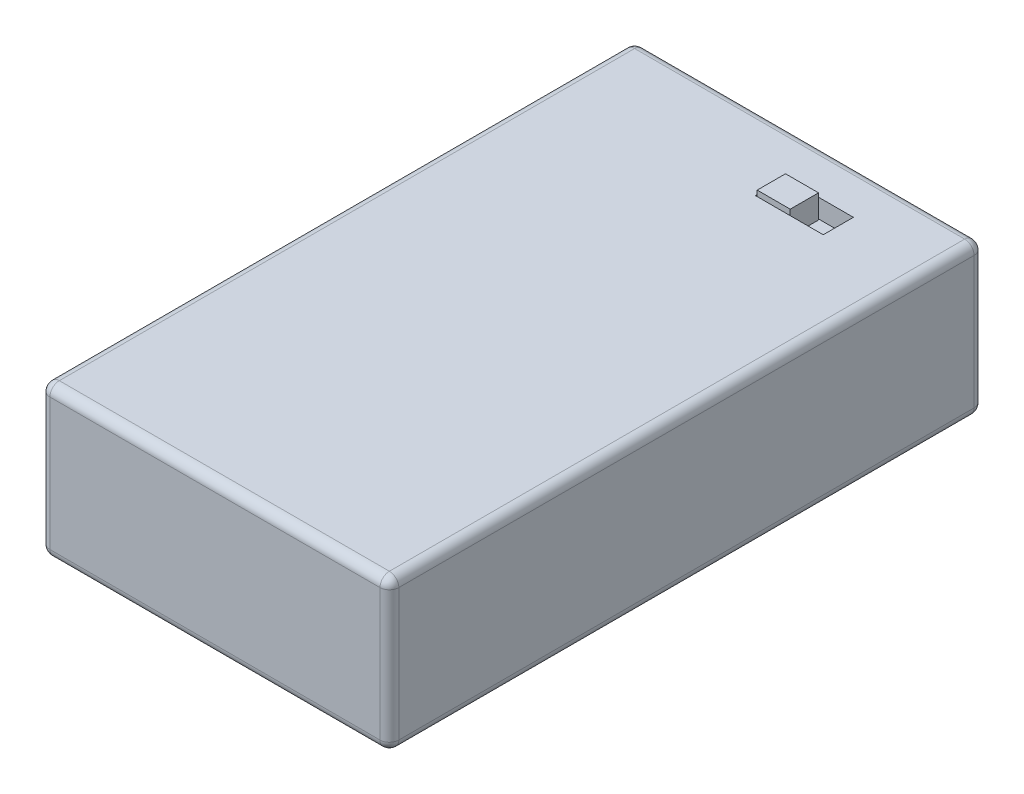
from build123d import *

# Parameters (mm, degrees)
SKETCH_1_W          = 37
SKETCH_1_H          = 63
EXTRUDE_1_DEPTH     = 16
FILLET_1_R          = 1
CUT_EXTRUDE_START   = 16
SKETCH_1_9_W        = 7.2
SKETCH_1_9_H        = 3.2
CUT_EXTRUDE_1_DEPTH = 2
EXTRUDE_START       = 14
SKETCH_1_10_W       = 3.5
SKETCH_1_10_H       = 3
EXTRUDE_2_DEPTH     = 2.5


with BuildPart() as part:
    # 草图1 → 凸台-拉伸1 (new body)
    with BuildSketch(Plane(origin=(0, 0, 0), x_dir=(1, 0, 0), z_dir=(0, 1, 0))):
        Rectangle(SKETCH_1_W, SKETCH_1_H)
    extrude(amount=EXTRUDE_1_DEPTH)

    # 圆角1
    fillet_1_edges = [part.edges().sort_by_distance(p)[0] for p in [
        (0, 16, -31.5),
        (-18.5, 16, 0),
        (0, 16, 31.5),
        (-18.5, 0, 0),
        (0, 0, -31.5),
        (18.5, 0, 0),
        (0, 0, 31.5),
        (-18.5, 8, 31.5),
        (-18.5, 8, -31.5),
        (18.5, 8, -31.5),
        (18.5, 8, 31.5),
        (18.5, 16, 0),
    ]]
    fillet(fillet_1_edges, radius=FILLET_1_R)

    # 草图1<9> → 切除-拉伸1 (cut)
    with BuildSketch(Plane(origin=(0, 0, 0), x_dir=(1, 0, 0), z_dir=(0, 1, 0)).offset(CUT_EXTRUDE_START)):
        with Locations((6, 25)):
            Rectangle(SKETCH_1_9_W, SKETCH_1_9_H)
    extrude(amount=-CUT_EXTRUDE_1_DEPTH, mode=Mode.SUBTRACT)

    # 草图1<10> → 凸台-拉伸2 (add)
    with BuildSketch(Plane(origin=(0, 0, 0), x_dir=(1, 0, 0), z_dir=(0, 1, 0)).offset(EXTRUDE_START)):
        with Locations((4.25, 25)):
            Rectangle(SKETCH_1_10_W, SKETCH_1_10_H)
    extrude(amount=EXTRUDE_2_DEPTH)


solid = part.part
